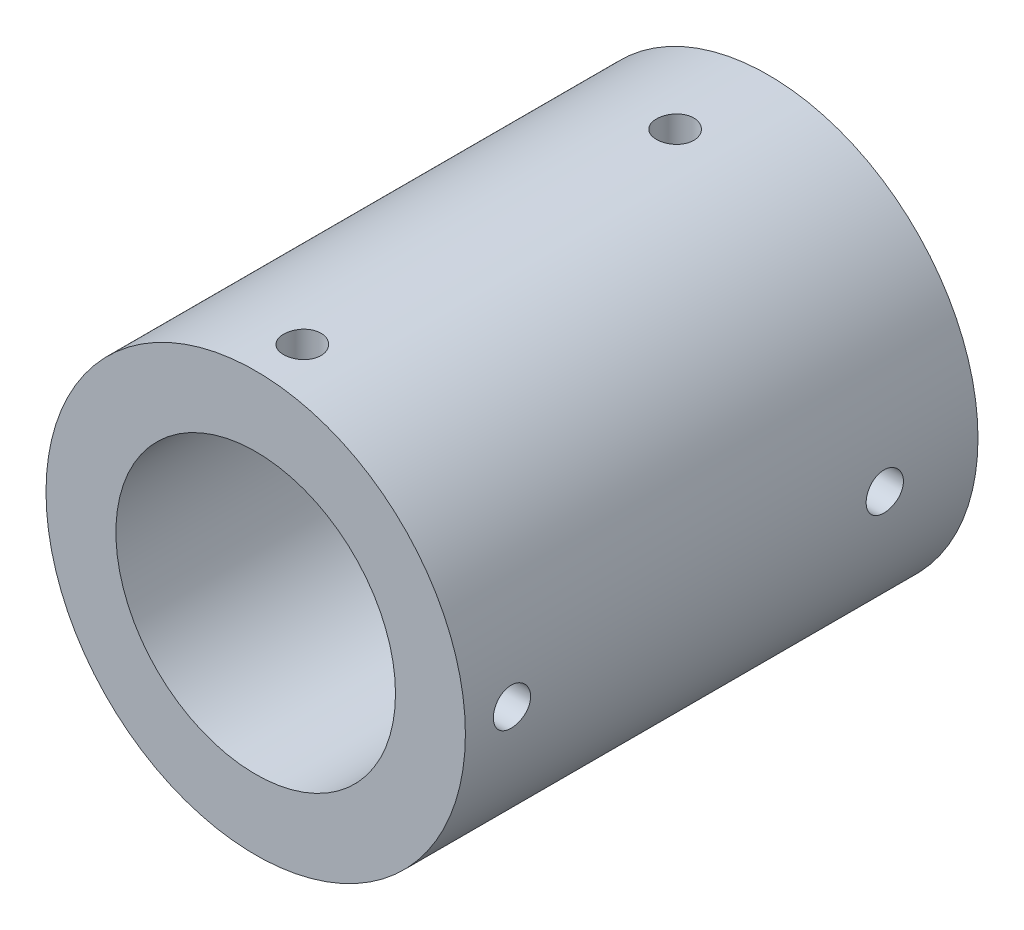
from build123d import *

# Parameters (mm, degrees)
SKIZZE1_R                       = 9
AUFSATZ_LINEAR_AUSTRAGEN1_DEPTH = 22
SKIZZE2_R                       = 6
SCHNITT_LINEAR_AUSTRAGEN1_DEPTH = 26.416530054
LINEARES_MUSTER1_COUNT          = 2
LINEARES_MUSTER1_PITCH          = 16
LINEARES_MUSTER2_COUNT          = 2
LINEARES_MUSTER2_PITCH          = 16


with BuildPart() as part:
    # Skizze1 → Aufsatz-Linear austragen1 (new body)
    with BuildSketch(Plane.XY):
        Circle(SKIZZE1_R)
    extrude(amount=AUFSATZ_LINEAR_AUSTRAGEN1_DEPTH)

    # Skizze2 → Schnitt-Linear austragen1 (cut, through all)
    with BuildSketch(Plane.XY.offset(22)):
        Circle(SKIZZE2_R)
    extrude(amount=-SCHNITT_LINEAR_AUSTRAGEN1_DEPTH, mode=Mode.SUBTRACT)

    # Skizze4 → M2 Gewindebohrung1 (revolve, cut)
    with BuildSketch(Plane(origin=(9, 0, 4), x_dir=(0, 0, -1), z_dir=(0, 1, 0))):
        Polygon((0, 0), (0, 6.480688495), (0.8, 6), (0.8, 0), align=None)
    m2_gewindebohrung1 = revolve(axis=Axis((15.35, 0, 4), (-1, 0, 0)), mode=Mode.SUBTRACT)

    # Skizze6 → M2 Gewindebohrung2 (revolve, cut)
    with BuildSketch(Plane(origin=(0, 9, 4), x_dir=(0, 0, 1), z_dir=(1, 0, 0))):
        Polygon((0, 0), (0, 6.480688495), (0.8, 6), (0.8, 0), align=None)
    m2_gewindebohrung2 = revolve(axis=Axis((0, 15.35, 4), (0, -1, 0)), mode=Mode.SUBTRACT)

    # Lineares Muster1: M2 Gewindebohrung1 ×2
    with Locations(*[(0, 0, i * LINEARES_MUSTER1_PITCH) for i in range(1, LINEARES_MUSTER1_COUNT)]):
        add(m2_gewindebohrung1, mode=Mode.SUBTRACT)

    # Lineares Muster2: M2 Gewindebohrung2 ×2
    with Locations(*[(0, 0, i * LINEARES_MUSTER2_PITCH) for i in range(1, LINEARES_MUSTER2_COUNT)]):
        add(m2_gewindebohrung2, mode=Mode.SUBTRACT)


solid = part.part
